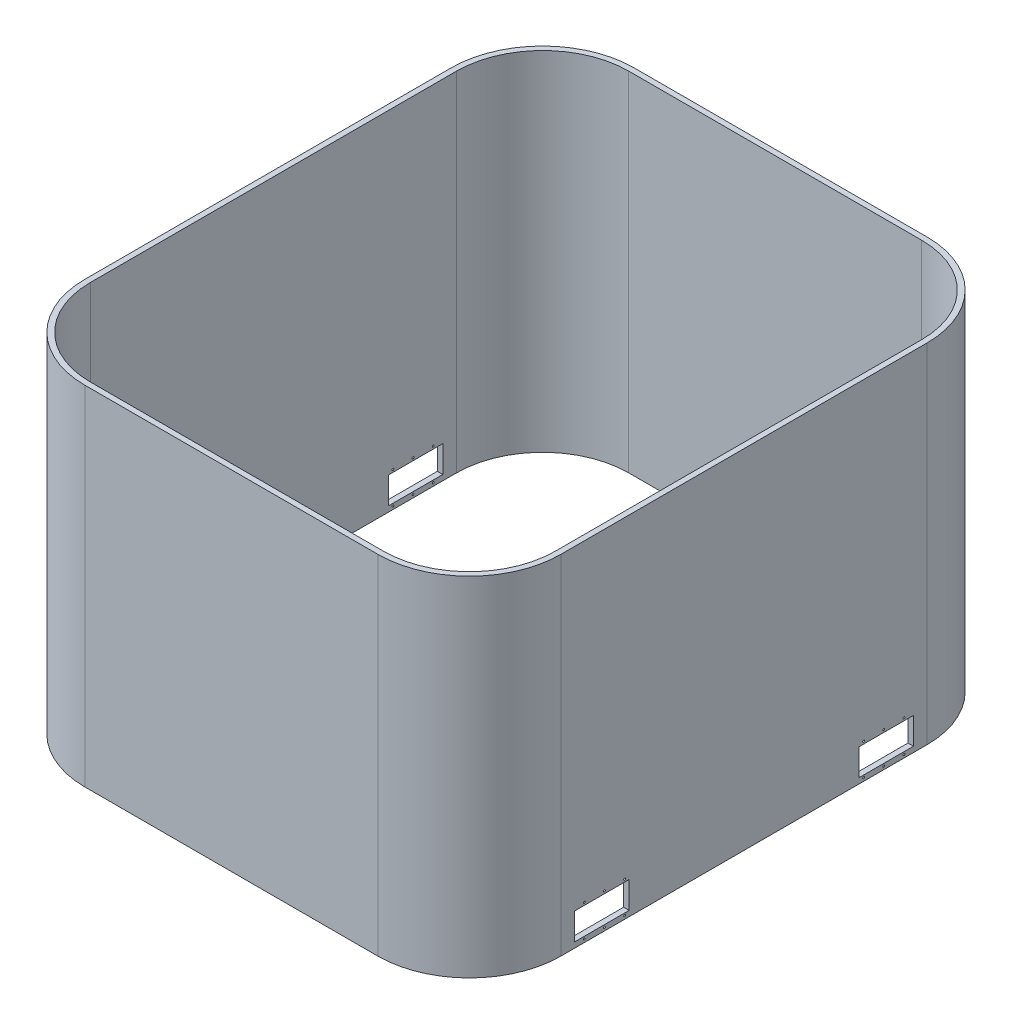
from build123d import *

# Parameters (mm, degrees)
CHAPALATERAL_DEPTH        = 380
MOTORTRASEIRO_DEPTH       = 707.113305355
MOTORTRASEIRO_DEPTH_BACK  = 707.113305355
ESBO_O8_W                 = 59.5
ESBO_O8_H                 = 29.2
MOTORFRONTAL_DEPTH        = 707.113305355
MOTORFRONTAL_DEPTH_BACK   = 707.113305355
ESBO_O10_W                = 59.5
ESBO_O10_H                = 29.2
FUROSDYNAMIXEL_DEPTH      = 711.492786733
FUROSDYNAMIXEL_DEPTH_BACK = 711.492786733
ESBO_O15_R                = 1.025


with BuildPart() as part:
    # Chapa inferior → ChapaLateral (new body)
    with BuildSketch(Plane(origin=(0, 0, 0), x_dir=(1, 0, 0), z_dir=(0, 1, 0))):
        with BuildLine():
            Line((-160, 300), (160, 300))
            ThreePointArc((160, 300), (230.710678119, 270.710678119), (260, 200))
            Line((260, 200), (260, -200))
            ThreePointArc((260, -200), (230.710678119, -270.710678119), (160, -300))
            Line((160, -300), (-160, -300))
            ThreePointArc((-160, -300), (-230.710678119, -270.710678119), (-260, -200))
            Line((-260, -200), (-260, 200))
            ThreePointArc((-260, 200), (-230.710678119, 270.710678119), (-160, 300))
        make_face()
        with BuildLine():
            Line((-160, 294), (160, 294))
            ThreePointArc((160, 294), (226.468037432, 266.468037432), (254, 200))
            Line((254, 200), (254, -200))
            ThreePointArc((254, -200), (226.468037432, -266.468037432), (160, -294))
            Line((160, -294), (-160, -294))
            ThreePointArc((-160, -294), (-226.468037432, -266.468037432), (-254, -200))
            Line((-254, -200), (-254, 200))
            ThreePointArc((-254, 200), (-226.468037432, 266.468037432), (-160, 294))
        make_face(mode=Mode.SUBTRACT)
    extrude(amount=CHAPALATERAL_DEPTH)

    # Esboço8 → MotorTraseiro (cut, two sides: drawn at the far end of the back side and taken through both)
    with BuildSketch(Plane.ZY.offset(-254).offset(-MOTORTRASEIRO_DEPTH_BACK)):
        with Locations((-155.25, 20.6)):
            Rectangle(ESBO_O8_W, ESBO_O8_H)
    extrude(amount=MOTORTRASEIRO_DEPTH + MOTORTRASEIRO_DEPTH_BACK, mode=Mode.SUBTRACT)

    # Esboço10 → MotorFrontal (cut, two sides: drawn at the far end of the back side and taken through both)
    with BuildSketch(Plane.ZY.offset(-254).offset(-MOTORFRONTAL_DEPTH_BACK)):
        with Locations((155.25, 20.6)):
            Rectangle(ESBO_O10_W, ESBO_O10_H)
    extrude(amount=MOTORFRONTAL_DEPTH + MOTORFRONTAL_DEPTH_BACK, mode=Mode.SUBTRACT)

    # Esboço15 → FurosDynamixel (cut, two sides: drawn at the far end of the back side and taken through both)
    with BuildSketch(Plane.ZY.offset(260).offset(-FUROSDYNAMIXEL_DEPTH_BACK)):
        with Locations((174.5, 38)):
            Circle(ESBO_O15_R)
        with Locations((152.5, 38)):
            Circle(ESBO_O15_R)
        with Locations((130.5, 38)):
            Circle(ESBO_O15_R)
        with Locations((152.5, 3.4)):
            Circle(ESBO_O15_R)
        with Locations((130.5, 3.4)):
            Circle(ESBO_O15_R)
        with Locations((174.5, 3.4)):
            Circle(ESBO_O15_R)
        with Locations((-174.5, 3.4)):
            Circle(ESBO_O15_R)
        with Locations((-130.5, 3.4)):
            Circle(ESBO_O15_R)
        with Locations((-152.5, 3.4)):
            Circle(ESBO_O15_R)
        with Locations((-130.5, 38)):
            Circle(ESBO_O15_R)
        with Locations((-152.5, 38)):
            Circle(ESBO_O15_R)
        with Locations((-174.5, 38)):
            Circle(ESBO_O15_R)
    extrude(amount=FUROSDYNAMIXEL_DEPTH + FUROSDYNAMIXEL_DEPTH_BACK, mode=Mode.SUBTRACT)


solid = part.part
